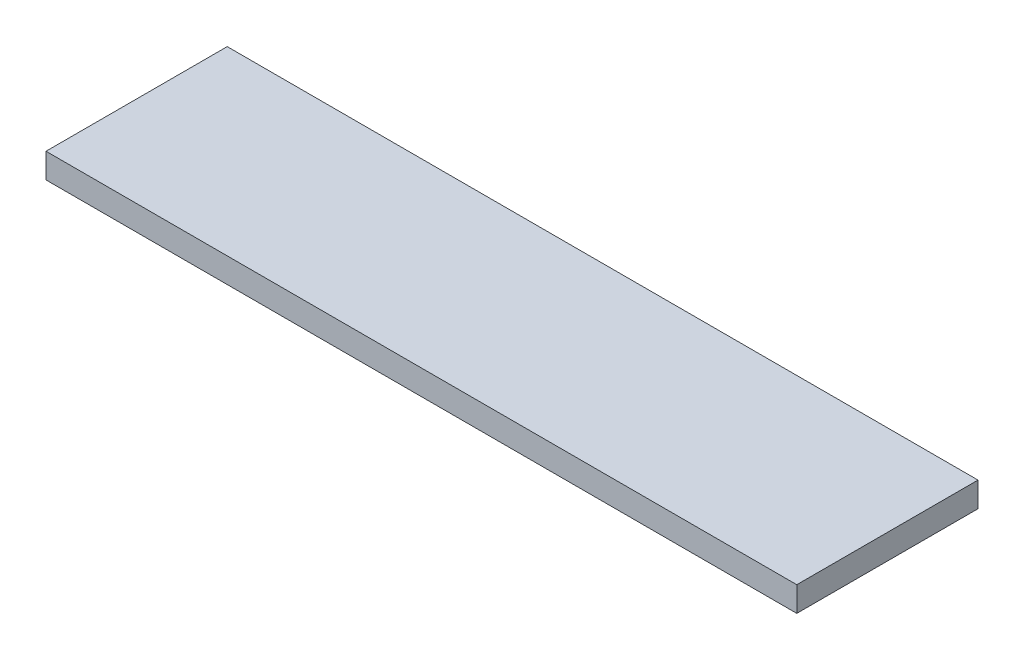
from build123d import *

# Parameters (mm, degrees)
SKETCH1_W           = 290
SKETCH1_H           = 70
BOSS_EXTRUDE1_DEPTH = 9.6


with BuildPart() as part:
    # Sketch1 → Boss-Extrude1 (new body)
    with BuildSketch(Plane(origin=(0, 0, 0), x_dir=(1, 0, 0), z_dir=(0, 1, 0))):
        Rectangle(SKETCH1_W, SKETCH1_H)
    extrude(amount=BOSS_EXTRUDE1_DEPTH)


solid = part.part
